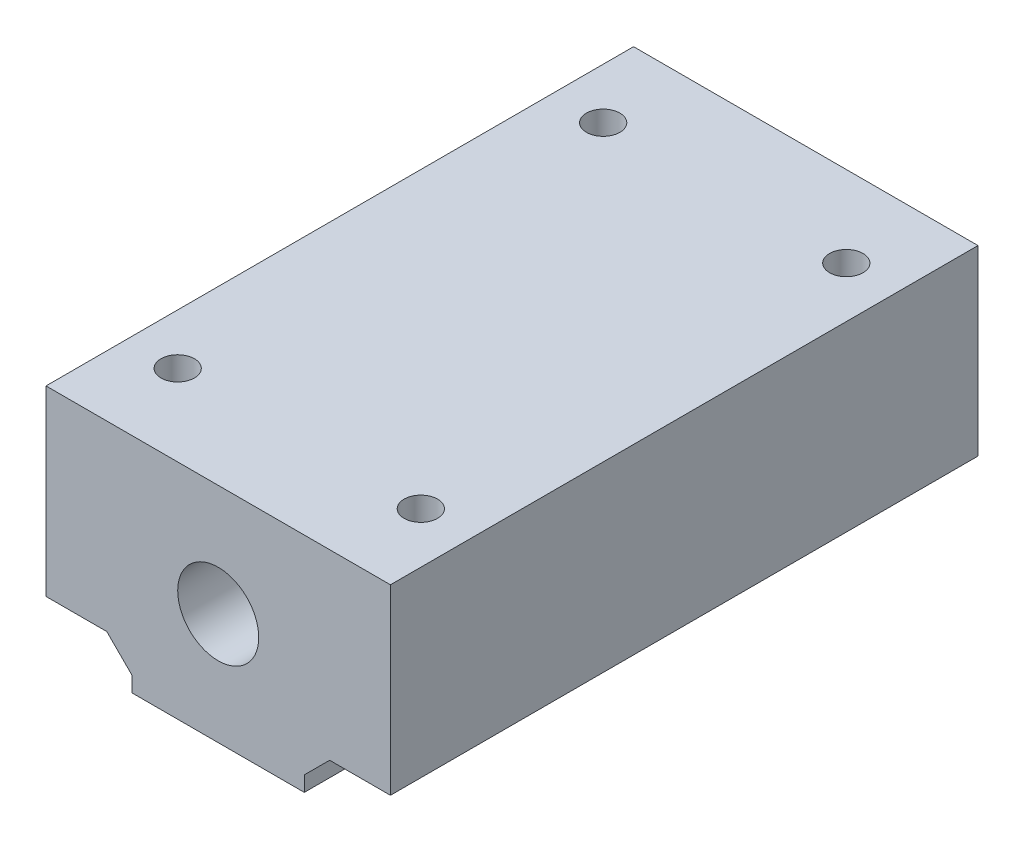
from build123d import *

# Parameters (mm, degrees)
SKETCH_1_R         = 4
EXTRUDE_1_DEPTH    = 58
HOLE_WIZARD_M4_1_D = 3.3


with BuildPart() as part:
    # 草图1 → 凸台-拉伸1 (new body)
    with BuildSketch(Plane.XY):
        Polygon((8.5, 0), (-8.5, 0), (-8.5, 1.5), (-11, 4), (-17, 4), (-17, 22), (17, 22), (17, 4), (11, 4), (8.5, 1.5), align=None)
        with Locations(Location((0, 11, 0), (0, 0, 180))):
            Circle(SKETCH_1_R, mode=Mode.SUBTRACT)
    extrude(amount=EXTRUDE_1_DEPTH)

    # M4 螺纹孔1 (through all)
    with Locations(Plane(origin=(0, 22, 0), x_dir=(-1, 0, 0), z_dir=(0, 1, 0))):
        with Locations((12, 50), (-12, 50), (-12, 8), (12, 8)):
            Hole(HOLE_WIZARD_M4_1_D / 2)


solid = part.part
